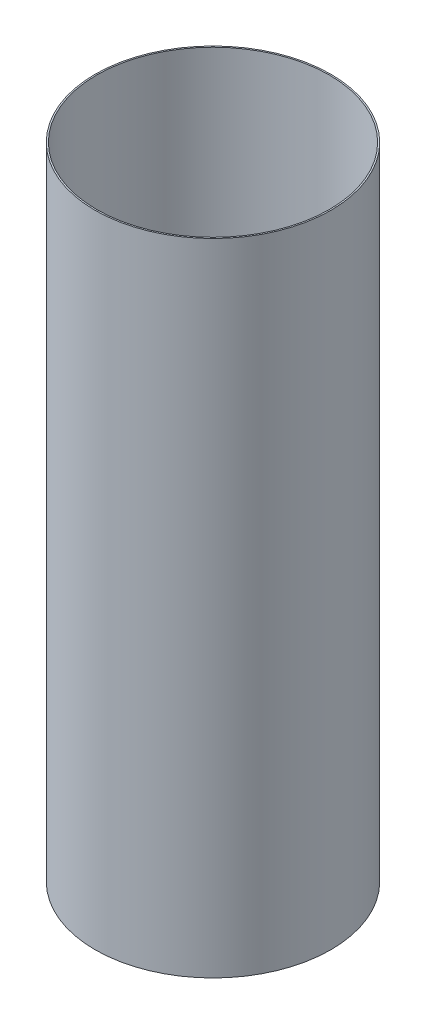
from build123d import *

# Parameters (mm, degrees)
SKETCH1_R           = 4050
SKETCH1_R_2         = 4000
BOSS_EXTRUDE1_DEPTH = 22000


with BuildPart() as part:
    # Sketch1 → Boss-Extrude1 (new body)
    with BuildSketch(Plane(origin=(0, 0, 0), x_dir=(1, 0, 0), z_dir=(0, 1, 0))):
        with Locations(Location((0, 0, 0), (0, 0, 270))):
            Circle(SKETCH1_R)
        with Locations(Location((0, 0, 0), (0, 0, 270))):
            Circle(SKETCH1_R_2, mode=Mode.SUBTRACT)
    extrude(amount=BOSS_EXTRUDE1_DEPTH)


solid = part.part
